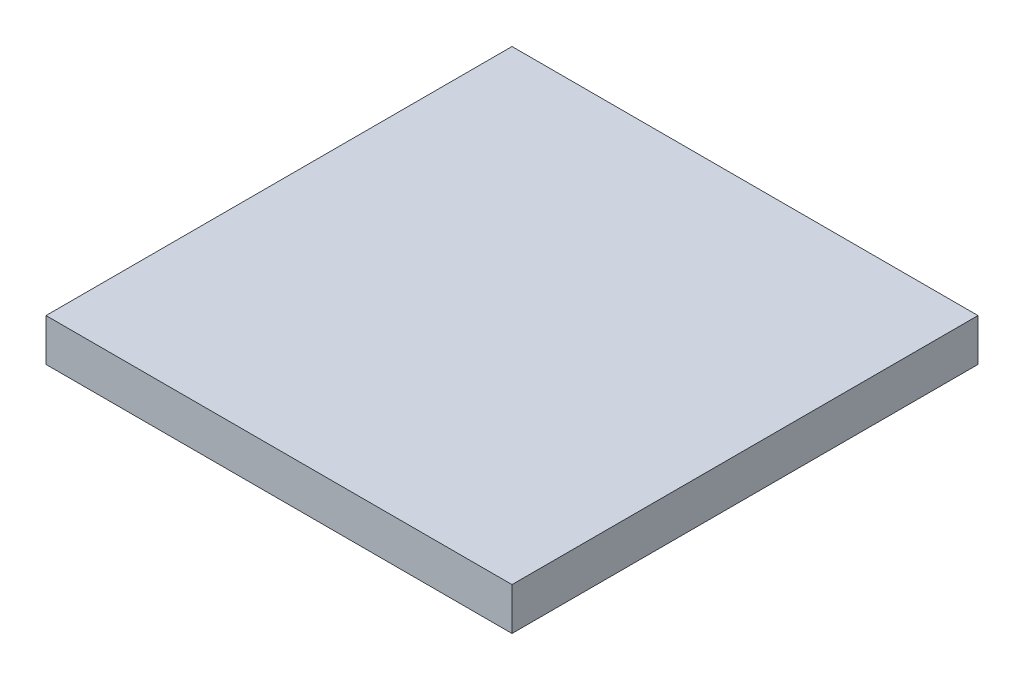
from build123d import *

# Parameters (mm, degrees)
CROQUIS1_W              = 55
CROQUIS1_H              = 55
SALIENTE_EXTRUIR1_DEPTH = 5


with BuildPart() as part:
    # Croquis1 → Saliente-Extruir1 (new body)
    with BuildSketch(Plane(origin=(0, 0, 0), x_dir=(1, 0, 0), z_dir=(0, 1, 0))):
        with Locations((27.5, 27.5)):
            Rectangle(CROQUIS1_W, CROQUIS1_H)
    extrude(amount=SALIENTE_EXTRUIR1_DEPTH)


solid = part.part
